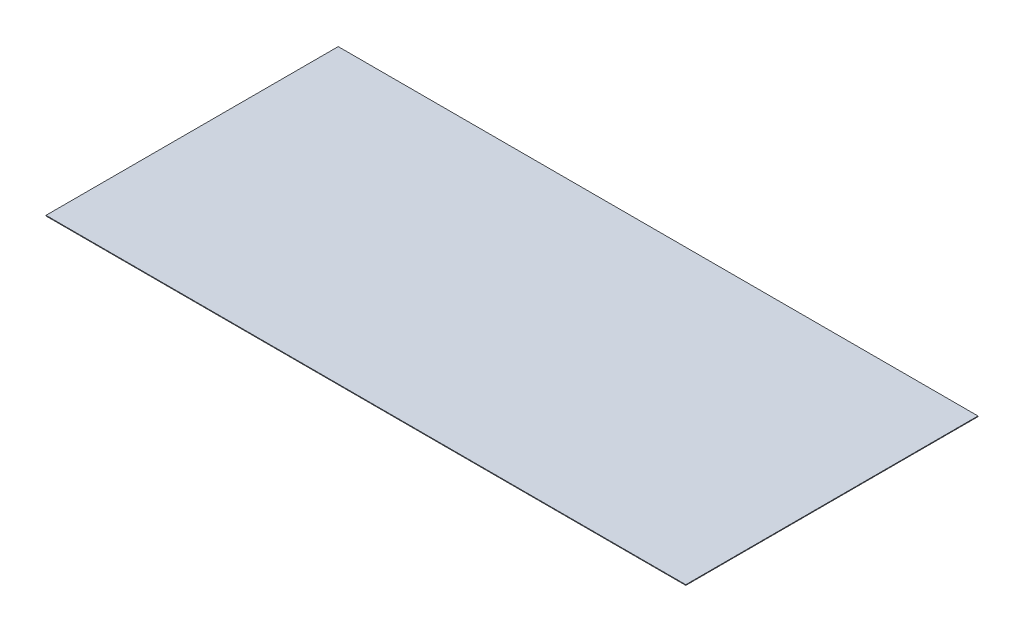
from build123d import *

# Parameters (mm, degrees)
ESQUISSE1_W        = 994
ESQUISSE1_H        = 454
BOSS_EXTRU_1_DEPTH = 1


with BuildPart() as part:
    # Esquisse1 → Boss.-Extru.1 (new body)
    with BuildSketch(Plane(origin=(0, 0, 0), x_dir=(1, 0, 0), z_dir=(0, 1, 0))):
        with Locations((497, 0)):
            Rectangle(ESQUISSE1_W, ESQUISSE1_H)
    extrude(amount=BOSS_EXTRU_1_DEPTH)


solid = part.part
